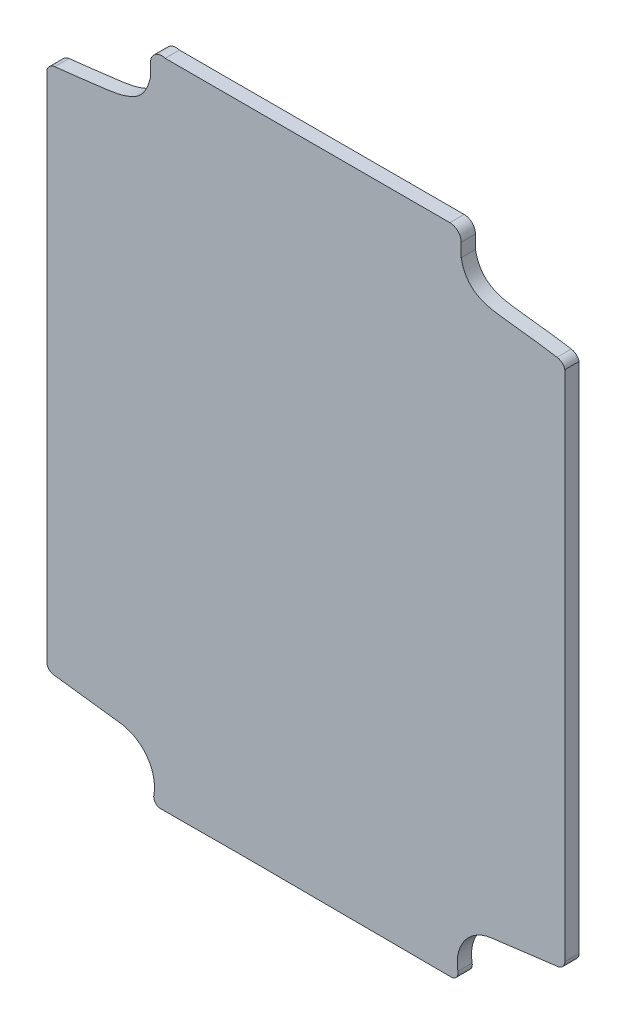
from build123d import *

# Parameters (mm, degrees)
BOSS_EXTRUDE4_DEPTH = 18
SKETCH6_R           = 18
CUT_EXTRUDE3_DEPTH  = 8


with BuildPart() as part:
    # Sketch1 → Boss-Extrude4 (new body)
    with BuildSketch(Plane.XY):
        with BuildLine():
            Line((213.665264782, 879.609661268), (572.9204346, 879.609661268))
            ThreePointArc((572.9204346, 879.609661268), (583.008118799, 875.43120566), (587.186574407, 865.343521461))
            Line((587.186574407, 865.343521461), (587.186574407, 848.420368984))
            add(Edge.make_bspline(
                [(587.186574407, 848.420368984), (591.829116762, 824.033314778), (611.99966791, 812.181249537), (684.599789251, 804.294995304), (694.209684908, 801.997984129), (708.065375119, 800.12559356)],
                knots=[0, 0, 0, 0, 0.276268626, 0.356158873, 1, 1, 1, 1], degree=3))
            ThreePointArc((708.065375119, 800.12559356), (714.29897317, 797.301145717), (717.952464771, 791.514328856))
            Line((717.952464771, 791.514328856), (717.952464771, 144.54509084))
            ThreePointArc((717.952464771, 144.54509084), (715.056603258, 137.553862701), (708.065375119, 134.658001188))
            Line((708.065375119, 134.658001188), (624.941397739, 124.091723183))
            ThreePointArc((624.941397739, 124.091723183), (591.555687243, 104.359066239), (583.008118799, 66.531530117))
            ThreePointArc((583.008118799, 66.531530117), (581.583341498, 59.765702844), (575.791709462, 55.98901019))
            Line((575.791709462, 55.98901019), (311.227107766, 57.049984824))
            Line((311.227107766, 57.049984824), (206.564905195, 56.63026147))
            ThreePointArc((206.564905195, 56.63026147), (200.773273159, 60.406954124), (199.348495858, 67.172781397))
            ThreePointArc((199.348495858, 67.172781397), (190.800927414, 105.000317519), (157.415216918, 124.732974463))
            Line((157.415216918, 124.732974463), (74.291239538, 135.299252468))
            ThreePointArc((74.291239538, 135.299252468), (67.300011399, 138.195113981), (64.404149886, 145.18634212))
            Line((64.404149886, 145.18634212), (64.404149886, 792.155580135))
            ThreePointArc((64.404149886, 792.155580135), (68.057641487, 797.942396997), (74.291239538, 800.76684484))
            add(Edge.make_bspline(
                [(195.17004025, 849.061620264), (190.007644225, 829.969181191), (180.523803756, 818.748392065), (154.390830928, 810.533653637), (101.841163507, 803.500501837), (88.146929749, 802.639235409), (74.291239538, 800.76684484)],
                knots=[0, 0, 0, 0, 0.202419016, 0.278084079, 0.357842178, 1, 1, 1, 1], degree=3))
            Line((195.17004025, 849.061620264), (195.17004025, 865.984772741))
            ThreePointArc((195.17004025, 865.984772741), (200.974796274, 877.470752432), (213.665264782, 879.609661268))
        make_face()
    extrude(amount=BOSS_EXTRUDE4_DEPTH)

    # Sketch6 → Cut-Extrude3 (cut)
    with BuildSketch(Plane.XY):
        with BuildLine():
            add(Edge.make_bspline(
                [(628.519559343, 733.853378718), (622.436437572, 736.602909747), (607.859561738, 739.081416435), (575.009381104, 729.569949895), (562.689219156, 695.402174255), (566.28876359, 775.877966835), (519.622606595, 773.821309119), (497.465177012, 734.524779905), (467.056936699, 703.690191779), (475.992120474, 664.141394999), (496.079665501, 638.85918076), (549.338361845, 634.325296579), (568.384751005, 670.062512479), (571.357487028, 653.538894898), (591.124630371, 641.065394514), (621.529923008, 634.266894409), (659.500621589, 653.98787965), (663.444716533, 700.526632138), (646.542188857, 722.387510607), (634.596545328, 731.106621024), (628.519559343, 733.853378718)],
                knots=[0, 0, 0, 0, 0.041950259, 0.101207505, 0.155785894, 0.286134428, 0.36268695, 0.37927771, 0.452042033, 0.533513298, 0.593085441, 0.660805367, 0.699094561, 0.737529829, 0.756250449, 0.796880914, 0.866236076, 0.918172316, 0.958092055, 1, 1, 1, 1], degree=3))
        make_face()
        with Locations((688.75494982, 774.427181113)):
            Circle(SKETCH6_R)
        with Locations((628.280746291, 765.77783866)):
            Circle(SKETCH6_R)
        with Locations((586.505184667, 794.503671146)):
            Circle(SKETCH6_R)
        with Locations((544.977256337, 848.420368984)):
            Circle(SKETCH6_R)
        with BuildLine():
            ThreePointArc((373.828073572, 842.809870876), (391.129238238, 854.710165383), (408.430402904, 842.809870876))
            Line((408.430402904, 842.809870876), (423.230194366, 842.809870876))
            Line((423.230194366, 842.809870876), (423.230194366, 829.886109318))
            Line((423.230194366, 829.886109318), (408.430402904, 829.886109318))
            ThreePointArc((408.430402904, 829.886109318), (391.129238238, 817.98581481), (373.828073572, 829.886109318))
            Line((373.828073572, 829.886109318), (358.194491042, 829.886109318))
            Line((358.194491042, 829.886109318), (358.194491042, 842.809870876))
            Line((358.194491042, 842.809870876), (373.828073572, 842.809870876))
        make_face()
        with Locations((390.534604697, 796.542472622)):
            Circle(SKETCH6_R)
        with Locations((236.881870191, 848.420368984)):
            Circle(SKETCH6_R)
        with Locations((194.83114996, 794.503671146)):
            Circle(SKETCH6_R)
        with BuildLine():
            add(Edge.make_bspline(
                [(153.208535675, 733.226292005), (159.291657445, 735.975823034), (173.86853328, 738.454329722), (206.718713914, 728.942863181), (219.038875861, 694.775087541), (215.439331427, 775.250880122), (262.105488423, 773.194222406), (284.262918006, 733.897693192), (314.671158319, 703.063105066), (305.735974544, 663.514308286), (285.648429517, 638.232094047), (232.389733173, 633.698209866), (213.343344013, 669.435425766), (210.37060799, 652.911808185), (190.603464646, 640.438307801), (160.198172009, 633.639807696), (122.227473429, 653.360792937), (118.283378485, 699.899545425), (135.185906161, 721.760423893), (147.131549689, 730.479534311), (153.208535675, 733.226292005)],
                knots=[0, 0, 0, 0, 0.041950259, 0.101207505, 0.155785894, 0.286134428, 0.36268695, 0.37927771, 0.452042033, 0.533513298, 0.593085441, 0.660805367, 0.699094561, 0.737529829, 0.756250449, 0.796880914, 0.866236076, 0.918172316, 0.958092055, 1, 1, 1, 1], degree=3))
        make_face()
        with Locations((153.208535675, 765.77783866)):
            Circle(SKETCH6_R)
        with Locations((92.788491292, 774.427181113)):
            Circle(SKETCH6_R)
        with BuildLine():
            ThreePointArc((683.046689386, 484.208081981), (694.946983893, 466.906917315), (683.046689386, 449.605752649))
            Line((683.046689386, 449.605752649), (683.046689386, 434.805961187))
            Line((683.046689386, 434.805961187), (670.122927828, 434.805961187))
            Line((670.122927828, 434.805961187), (670.122927828, 449.605752649))
            ThreePointArc((670.122927828, 449.605752649), (658.222633321, 466.906917315), (670.122927828, 484.208081981))
            Line((670.122927828, 484.208081981), (670.122927828, 499.841664511))
            Line((670.122927828, 499.841664511), (683.046689386, 499.841664511))
            Line((683.046689386, 499.841664511), (683.046689386, 484.208081981))
        make_face()
        with Locations((632.442252347, 466.906917315)):
            Circle(SKETCH6_R)
        with Locations((148.684237263, 466.906917315)):
            Circle(SKETCH6_R)
        with BuildLine():
            add(Edge.make_bspline(
                [(152.769709915, 199.951758541), (158.852831686, 197.202227513), (173.429707521, 194.723720824), (206.279888155, 204.235187365), (218.600050102, 238.402963005), (215.000505668, 157.927170424), (261.666662664, 159.983828141), (283.824092246, 199.280357354), (314.23233256, 230.11494548), (305.297148784, 269.66374226), (285.209603758, 294.945956499), (231.950907414, 299.47984068), (212.904518254, 263.74262478), (209.931782231, 280.266242361), (190.164638887, 292.739742745), (159.75934625, 299.538242851), (121.788647669, 279.817257609), (117.844552725, 233.278505121), (134.747080402, 211.417626653), (146.69272393, 202.698516236), (152.769709915, 199.951758541)],
                knots=[0, 0, 0, 0, 0.041950259, 0.101207505, 0.155785894, 0.286134428, 0.36268695, 0.37927771, 0.452042033, 0.533513298, 0.593085441, 0.660805367, 0.699094561, 0.737529829, 0.756250449, 0.796880914, 0.866236076, 0.918172316, 0.958092055, 1, 1, 1, 1], degree=3))
        make_face()
        with BuildLine():
            add(Edge.make_bspline(
                [(627.920021241, 200.625679272), (621.83689947, 197.876148243), (607.260023635, 195.397641555), (574.409843001, 204.909108095), (562.089681054, 239.076883735), (565.689225488, 158.601091155), (519.023068492, 160.657748871), (496.86563891, 199.954278085), (466.457398596, 230.788866211), (475.392582372, 270.337662991), (495.480127398, 295.61987723), (548.738823742, 300.153761411), (567.785212902, 264.416545511), (570.757948925, 280.940163092), (590.525092269, 293.413663476), (620.930384906, 300.212163581), (658.901083487, 280.49117834), (662.845178431, 233.952425852), (645.942650754, 212.091547383), (633.997007226, 203.372436966), (627.920021241, 200.625679272)],
                knots=[0, 0, 0, 0, 0.041950259, 0.101207505, 0.155785894, 0.286134428, 0.36268695, 0.37927771, 0.452042033, 0.533513298, 0.593085441, 0.660805367, 0.699094561, 0.737529829, 0.756250449, 0.796880914, 0.866236076, 0.918172316, 0.958092055, 1, 1, 1, 1], degree=3))
        make_face()
        with Locations((544.977256337, 85.851834909)):
            Circle(SKETCH6_R)
        with Locations((586.505184667, 139.528569683)):
            Circle(SKETCH6_R)
        with Locations((628.280746291, 168.479267413)):
            Circle(SKETCH6_R)
        with Locations((688.75494982, 159.288236475)):
            Circle(SKETCH6_R)
        with Locations((390.173892162, 137.792406875)):
            Circle(SKETCH6_R)
        with BuildLine():
            ThreePointArc((373.669173202, 104.509246607), (390.970337868, 116.409541114), (408.271502534, 104.509246607))
            Line((408.271502534, 104.509246607), (423.071293996, 104.509246607))
            Line((423.071293996, 104.509246607), (423.071293996, 91.585485049))
            Line((423.071293996, 91.585485049), (408.271502534, 91.585485049))
            ThreePointArc((408.271502534, 91.585485049), (390.970337868, 79.685190541), (373.669173202, 91.585485049))
            Line((373.669173202, 91.585485049), (358.035590672, 91.585485049))
            Line((358.035590672, 91.585485049), (358.035590672, 104.509246607))
            Line((358.035590672, 104.509246607), (373.669173202, 104.509246607))
        make_face()
        with Locations((236.881870191, 85.851834909)):
            Circle(SKETCH6_R)
        with Locations((194.83114996, 139.528569683)):
            Circle(SKETCH6_R)
        with Locations((153.208535675, 168.479267413)):
            Circle(SKETCH6_R)
        with Locations((92.788491292, 159.288236475)):
            Circle(SKETCH6_R)
        with BuildLine():
            ThreePointArc((98.72158661, 484.208081981), (86.821292103, 466.906917315), (98.72158661, 449.605752649))
            Line((98.72158661, 449.605752649), (98.72158661, 434.805961187))
            Line((98.72158661, 434.805961187), (111.645348168, 434.805961187))
            Line((111.645348168, 434.805961187), (111.645348168, 449.605752649))
            ThreePointArc((111.645348168, 449.605752649), (123.545642676, 466.906917315), (111.645348168, 484.208081981))
            Line((111.645348168, 484.208081981), (111.645348168, 499.841664511))
            Line((111.645348168, 499.841664511), (98.72158661, 499.841664511))
            Line((98.72158661, 499.841664511), (98.72158661, 484.208081981))
        make_face()
    extrude(amount=CUT_EXTRUDE3_DEPTH, mode=Mode.SUBTRACT)


solid = part.part
